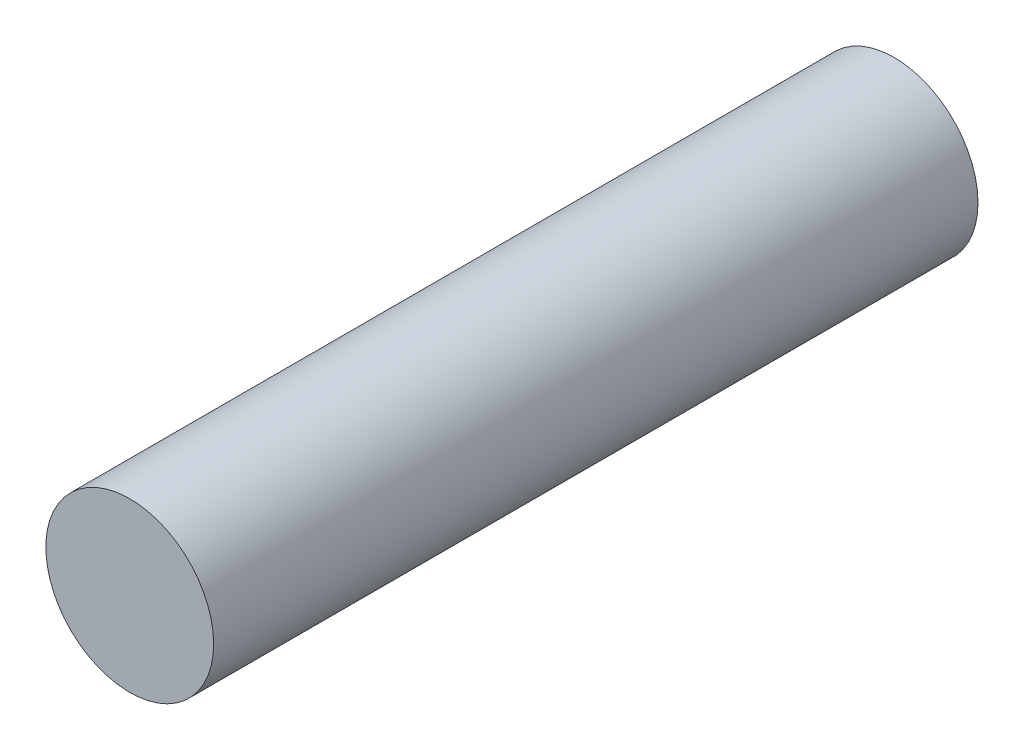
from build123d import *

# Parameters (mm, degrees)
SKETCH_1_R      = 4.5
EXTRUDE_1_DEPTH = 41


with BuildPart() as part:
    # 草图1 → 凸台-拉伸1 (new body)
    with BuildSketch(Plane.XY):
        Circle(SKETCH_1_R)
    extrude(amount=EXTRUDE_1_DEPTH)


solid = part.part
